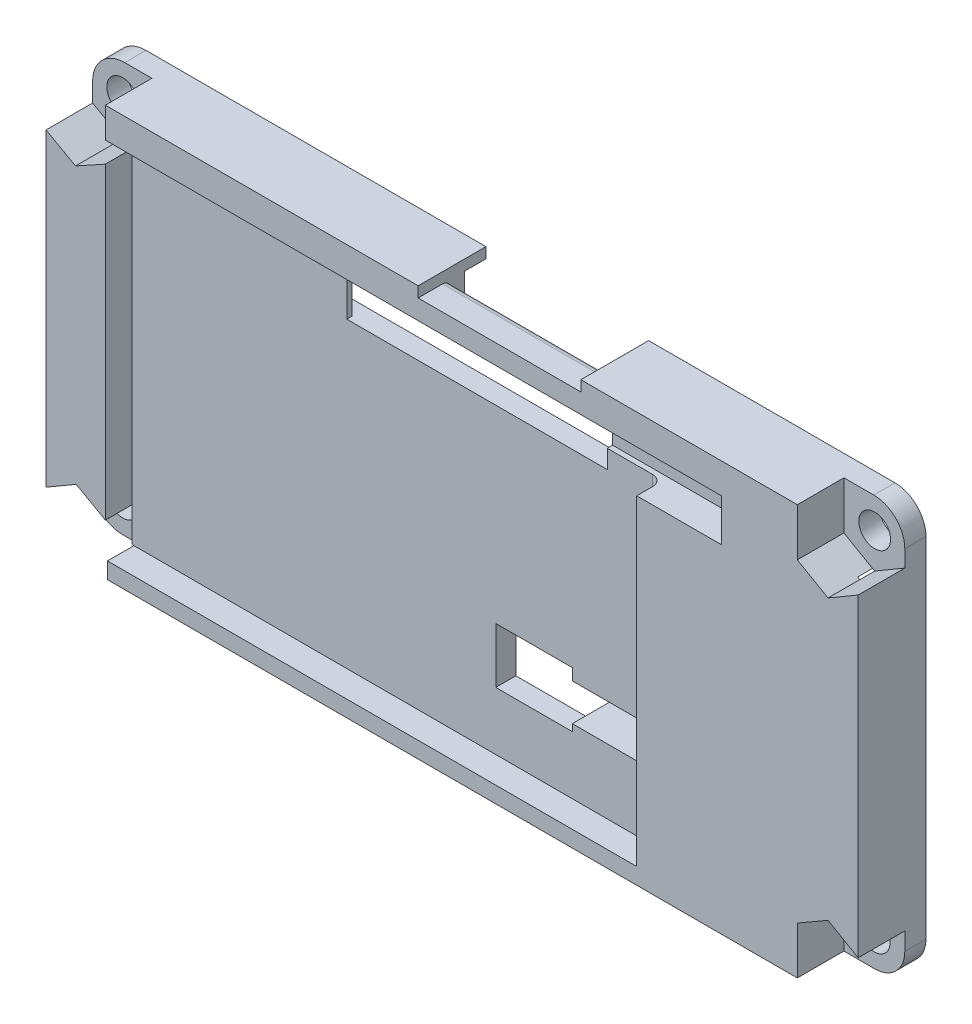
from build123d import *

# Parameters (mm, degrees)
SKETCH_1_R          = 1.5
EXTRUDE_1_DEPTH     = 2
EXTRUDE_1_2_DEPTH   = 2
EXTRUDE_1_3_DEPTH   = 2
SKETCH_1_W          = 4.106423221
SKETCH_1_H          = 16.094809644
EXTRUDE_1_4_DEPTH   = 2
EXTRUDE_2_DEPTH     = 1.4
SKETCH_3_W          = 7.227966662
SKETCH_3_H          = 7.026031467
EXTRUDE_3_DEPTH     = 1.4
SKETCH_4_R          = 1.5
CUT_EXTRUDE_1_DEPTH = 4
EXTRUDE_4_DEPTH     = 3
SKETCH_6_W          = 8
SKETCH_6_H          = 4
CUT_EXTRUDE_2_DEPTH = 3
SKETCH_7_W          = 15.36645454
SKETCH_7_H          = 1
CUT_EXTRUDE_3_DEPTH = 10
FILLET_1_R          = 0.7
CUT_EXTRUDE_START   = -3.4
CUT_EXTRUDE_4_DEPTH = 3.4
SKETCH_9_W          = 0.2
SKETCH_9_H          = 16.094809644
CUT_EXTRUDE_5_DEPTH = 2
SKETCH_10_W         = 0.2
SKETCH_10_H         = 13.963463774
CUT_EXTRUDE_6_DEPTH = 1.4
EXTRUDE_5_DEPTH     = 0.5
FILLET_2_R          = 1
SKETCH_12_W         = 5.692016437
SKETCH_12_H         = 1
SKETCH_12_W_2       = 23.13982976
EXTRUDE_6_DEPTH     = 2


with BuildPart() as part:
    # 草图1 → 凸台-拉伸1 (new body)
    with BuildSketch(Plane.XY):
        with BuildLine():
            Line((-73.533147066, 38.595377191), (-64.568453137, 38.595377191))
            Line((-64.568453137, 38.595377191), (-64.568453137, 29.995377191))
            Line((-64.568453137, 29.995377191), (-75.268453137, 29.995377191))
            Line((-75.268453137, 29.995377191), (-75.268453137, 9.185699771))
            Line((-75.268453137, 9.185699771), (-68.568453137, 9.185699771))
            Line((-68.568453137, 9.185699771), (-68.568453137, -0.114300229))
            Line((-68.568453137, -0.114300229), (-73.787147574, -0.114300229))
            ThreePointArc((-73.787147574, -0.114300229), (-75.753827598, 0.70032531), (-76.568453137, 2.667005334))
            Line((-76.568453137, 2.667005334), (-76.568453137, 35.56007112))
            ThreePointArc((-76.568453137, 35.56007112), (-75.679432572, 37.706356626), (-73.533147066, 38.595377191))
        make_face()
        with Locations((-73.729232918, 35.767081534)):
            Circle(SKETCH_1_R, mode=Mode.SUBTRACT)
        with Locations((-73.729232918, 2.75501651)):
            Circle(SKETCH_1_R, mode=Mode.SUBTRACT)
    extrude(amount=EXTRUDE_1_DEPTH)



with BuildPart() as body_2:
    # 草图1 → Extrude 1 2 (new body)
    with BuildSketch(Plane.XY):
        with BuildLine():
            Line((-20.3701524, 38.595377191), (-2.794005588, 38.595377191))
            ThreePointArc((-2.794005588, 38.595377191), (-0.726529172, 37.739000419), (0.1298476, 35.671524003))
            Line((0.1298476, 35.671524003), (0.1298476, 2.730505461))
            ThreePointArc((0.1298476, 2.730505461), (-0.703376696, 0.718924067), (-2.71495809, -0.114300229))
            Line((-2.71495809, -0.114300229), (-29.3701524, -0.114300229))
            Line((-29.3701524, -0.114300229), (-29.3701524, 7.564313638))
            Line((-29.3701524, 7.564313638), (-21.352987273, 7.564313638))
            Line((-21.352987273, 7.564313638), (-21.352987273, 2.696314027))
            Line((-21.352987273, 2.696314027), (-7.783666391, 2.696314027))
            Line((-7.783666391, 2.696314027), (-7.783666391, 2.08224545))
            Line((-7.783666391, 2.08224545), (-5.4155429, 2.08224545))
            Line((-5.4155429, 2.08224545), (-5.4155429, 6.727722904))
            Line((-5.4155429, 6.727722904), (-4.939400428, 6.727722904))
            Line((-4.939400428, 6.727722904), (-4.939400428, 11.903025146))
            Line((-4.939400428, 11.903025146), (-1.774003048, 11.903025146))
            Line((-1.774003048, 11.903025146), (-1.774003048, 30.503061971))
            ThreePointArc((-1.774003048, 30.503061971), (-3.774007689, 32.503066612), (-5.774012331, 30.503061971))
            Line((-5.774012331, 30.503061971), (-5.774012331, 29.995362765))
            Line((-5.774012331, 29.995362765), (-20.3701524, 29.995362765))
            Line((-20.3701524, 29.995362765), (-20.3701524, 38.595377191))
        make_face()
    extrude(amount=EXTRUDE_1_2_DEPTH)

    # 草图2 → 凸台-拉伸2 (add)
    with BuildSketch(Plane.XY.offset(2)):
        with BuildLine():
            Line((-20.3701524, 38.595377191), (-5.61889189, 38.595377191))
            Line((-5.61889189, 38.595377191), (-5.61889189, 34.083758146))
            Line((-5.61889189, 34.083758146), (-2.721714642, 32.416318003))
            Line((-2.721714642, 32.416318003), (0.1298476, 34.083758146))
            Line((0.1298476, 34.083758146), (0.1298476, 4.412767613))
            Line((0.1298476, 4.412767613), (-2.721714642, 6.053954515))
            Line((-2.721714642, 6.053954515), (-5.620189722, 4.380519147))
            Line((-5.620189722, 4.380519147), (-5.620189722, -0.114300229))
            Line((-5.620189722, -0.114300229), (-29.3701524, -0.114300229))
            Line((-29.3701524, -0.114300229), (-29.3701524, 7.564313638))
            Line((-29.3701524, 7.564313638), (-21.352987273, 7.564313638))
            Line((-21.352987273, 7.564313638), (-20.749621985, 7.564313638))
            ThreePointArc((-20.749621985, 7.564313638), (-18.039737166, 8.686784683), (-16.917266121, 11.396669503))
            Line((-16.917266121, 11.396669503), (-16.917266121, 11.903025146))
            Line((-16.917266121, 11.903025146), (-4.939400428, 11.903025146))
            Line((-4.939400428, 11.903025146), (-1.774003048, 11.903025146))
            Line((-1.774003048, 11.903025146), (-1.774003048, 30.503061971))
            ThreePointArc((-1.774003048, 30.503061971), (-3.774007689, 32.503066612), (-5.774012331, 30.503061971))
            Line((-5.774012331, 30.503061971), (-5.774012331, 29.995362765))
            Line((-5.774012331, 29.995362765), (-20.3701524, 29.995362765))
            Line((-20.3701524, 29.995362765), (-20.3701524, 38.595377191))
        make_face()
        with BuildLine():
            Line((-70.887589638, 38.595377191), (-41.428623377, 38.595377191))
            Line((-41.428623377, 38.595377191), (-41.428623377, 35.071751605))
            Line((-41.428623377, 35.071751605), (-56.286166586, 35.071751605))
            ThreePointArc((-56.286166586, 35.071751605), (-59.39593239, 33.783644433), (-60.684039561, 30.673878629))
            Line((-60.684039561, 30.673878629), (-60.684039561, 29.995362765))
            Line((-60.684039561, 29.995362765), (-64.568453137, 29.995377191))
            Line((-64.568453137, 29.995377191), (-75.268453137, 29.995377191))
            Line((-75.268453137, 29.995377191), (-75.268453137, 9.185699771))
            Line((-75.268453137, 9.185699771), (-68.568453137, 9.185699771))
            Line((-68.568453137, 9.185699771), (-68.568453137, 11.798156954))
            Line((-68.568453137, 11.798156954), (-55.996988093, 11.798156954))
            Line((-55.996988093, 11.798156954), (-55.996988093, 25.761620728))
            Line((-55.996988093, 25.761620728), (-51.890564872, 25.761620728))
            Line((-51.890564872, 25.761620728), (-51.890564872, 29.995362765))
            Line((-51.890564872, 29.995362765), (-21.162764526, 29.995362765))
            Line((-21.162764526, 29.995362765), (-20.622217716, 29.369045696))
            Line((-20.622217716, 29.369045696), (-20.622217716, 22.554127025))
            Line((-20.622217716, 22.554127025), (-20.622217716, 16.103096986))
            Line((-20.622217716, 16.103096986), (-21.974006869, 16.103096986))
            ThreePointArc((-21.974006869, 16.103096986), (-24.074042789, 14.003061066), (-21.974006869, 11.903025146))
            Line((-21.974006869, 11.903025146), (-21.352987273, 11.903025146))
            Line((-21.352987273, 11.903025146), (-21.352987273, 11.060546498))
            Line((-21.352987273, 11.060546498), (-29.3701524, 11.060546498))
            Line((-29.3701524, 11.060546498), (-29.3701524, 12.144142136))
            Line((-29.3701524, 12.144142136), (-36.598119062, 12.144142136))
            Line((-36.598119062, 12.144142136), (-36.598119062, -0.114300229))
            Line((-36.598119062, -0.114300229), (-70.770319773, -0.114300229))
            Line((-70.770319773, -0.114300229), (-70.770319773, 4.547869094))
            Line((-70.770319773, 4.547869094), (-73.7192537, 6.209024912))
            Line((-73.7192537, 6.209024912), (-76.568453137, 4.547869094))
            Line((-76.568453137, 4.547869094), (-76.568453137, 33.773368738))
            Line((-76.568453137, 33.773368738), (-73.787147574, 32.214579336))
            Line((-73.787147574, 32.214579336), (-70.968453137, 33.773368738))
            Line((-70.968453137, 33.773368738), (-70.968453137, 38.595377191))
            Line((-70.968453137, 38.595377191), (-70.887589638, 38.595377191))
        make_face()
    extrude(amount=EXTRUDE_2_DEPTH)


with BuildPart() as body_3:
    # 草图1 → Extrude 1 3 (new body)
    with BuildSketch(Plane.XY):
        with BuildLine():
            Line((-29.3701524, 16.285673783), (-25.719430689, 16.285673783))
            Line((-25.719430689, 16.285673783), (-25.719430689, 22.554127025))
            Line((-25.719430689, 22.554127025), (-20.622217716, 22.554127025))
            Line((-20.622217716, 22.554127025), (-20.622217716, 16.103096986))
            Line((-20.622217716, 16.103096986), (-21.974006869, 16.103096986))
            ThreePointArc((-21.974006869, 16.103096986), (-24.074042789, 14.003061066), (-21.974006869, 11.903025146))
            Line((-21.974006869, 11.903025146), (-21.352987273, 11.903025146))
            Line((-21.352987273, 11.903025146), (-21.352987273, 11.060546498))
            Line((-21.352987273, 11.060546498), (-29.3701524, 11.060546498))
            Line((-29.3701524, 11.060546498), (-29.3701524, 16.285673783))
        make_face()
    extrude(amount=EXTRUDE_1_3_DEPTH)


with BuildPart() as body_4:
    # 草图1 → Extrude 1 4 (new body)
    with BuildSketch(Plane.XY):
        with Locations((-53.943776483, 17.714215906)):
            Rectangle(SKETCH_1_W, SKETCH_1_H)
    extrude(amount=EXTRUDE_1_4_DEPTH)


with BuildPart() as extrude_2_piece_1:
    # of the separate pieces the step leaves, piece 1, a body of its own (extrude_2_pieces)
    add(body_2.part.solids().sort_by_distance((-41.428623377, 38.595377191, 2))[0])


with BuildPart() as extrude_2_piece_2:
    # of the separate pieces the step leaves, piece 2, a body of its own (extrude_2_pieces)
    add(body_2.part.solids().sort_by_distance((-5.774012331, 30.503061971, 0))[0])


with BuildPart() as part_1:
    add(part.part)

    add(body_4.part)  # 凸台-拉伸3 merges body 4

    add(extrude_2_piece_1.part)  # 凸台-拉伸3 merges 凸台-拉伸2 piece 1

    add(extrude_2_piece_2.part)  # 凸台-拉伸3 merges 凸台-拉伸2 piece 2
    # 草图3 → 凸台-拉伸3 (add)
    with BuildSketch(Plane.XY.offset(3.4)):
        Polygon((-20.3701524, 38.595377191), (-20.3701524, 29.995362765), (-20.622217716, 29.995362765), (-20.622217716, 29.369045696), (-21.162764526, 29.995362765), (-26.062168837, 29.995362765), (-26.062168837, 38.595377191), align=None)
        with Locations((-32.984135731, 3.398715505)):
            Rectangle(SKETCH_3_W, SKETCH_3_H)
        with BuildLine():
            Line((-72.936706259, 9.185699771), (-75.268453137, 9.185699771))
            Line((-75.268453137, 9.185699771), (-75.268453137, 11.40305698))
            Line((-75.268453137, 11.40305698), (-75.268453137, 11.798156954))
            Line((-75.268453137, 11.798156954), (-75.008222616, 11.798156954))
            Line((-75.008222616, 11.798156954), (-75.008222616, 11.40305698))
            ThreePointArc((-75.008222616, 11.40305698), (-72.934110955, 9.328945319), (-70.859999295, 11.40305698))
            Line((-70.859999295, 11.40305698), (-70.859999295, 11.798156954))
            Line((-70.859999295, 11.798156954), (-68.568453137, 11.798156954))
            Line((-68.568453137, 11.798156954), (-68.568453137, 9.185699771))
            Line((-68.568453137, 9.185699771), (-72.936706259, 9.185699771))
        make_face()
        with BuildLine():
            Line((-51.890564872, 27.903055626), (-51.890564872, 25.761620728))
            Line((-51.890564872, 25.761620728), (-54.570638132, 25.761620728))
            ThreePointArc((-54.570638132, 25.761620728), (-53.053936471, 26.388408915), (-52.422198631, 27.903055626))
            Line((-52.422198631, 27.903055626), (-52.422198631, 29.995362765))
            Line((-52.422198631, 29.995362765), (-51.890564872, 29.995362765))
            Line((-51.890564872, 29.995362765), (-51.890564872, 27.903055626))
        make_face()
    extrude(amount=-EXTRUDE_3_DEPTH)

    # 草图4 → 切除-拉伸1 (cut)
    with BuildSketch(Plane.XY.offset(3.4)):
        with Locations(Location((-2.71495809, 35.750571501, 0), (0, 0, 180))):
            Circle(SKETCH_4_R)
        with Locations(Location((-2.75986538, 2.75501651, 0), (0, 0, 180))):
            Circle(SKETCH_4_R)
    extrude(amount=-CUT_EXTRUDE_1_DEPTH, mode=Mode.SUBTRACT)

    # 草图5 → 凸台-拉伸4 (add)
    with BuildSketch(Plane.XY.offset(3.4)):
        Polygon((-26.062168837, 38.595377191), (-5.61889189, 38.595377191), (-5.61889189, 34.083758146), (-2.721714642, 32.416318003), (0.1298476, 34.083758146), (0.1298476, 4.412767613), (-2.721714642, 6.053954515), (-5.620189722, 4.380519147), (-5.620189722, -0.114300229), (-70.770319773, -0.114300229), (-70.770319773, 1.42117871), (-20.786805854, 1.42117871), (-20.786805854, 35.738925441), (-70.968453137, 35.738925441), (-70.968453137, 38.595377191), align=None)
        Polygon((-76.568453137, 33.773368738), (-73.787147574, 32.214579336), (-70.968453137, 33.773368738), (-70.968453137, 4.659479052), (-73.7192537, 6.209024912), (-76.568453137, 4.547869094), align=None)
    extrude(amount=EXTRUDE_4_DEPTH)

    # 草图6 → 切除-拉伸2 (cut)
    with BuildSketch(Plane.XY.offset(6.4)):
        with Locations((-16.786805854, 33.738925441)):
            Rectangle(SKETCH_6_W, SKETCH_6_H)
    extrude(amount=-CUT_EXTRUDE_2_DEPTH, mode=Mode.SUBTRACT)

    # 草图7 → 切除-拉伸3 (cut)
    with BuildSketch(Plane(origin=(0, 0, 3.4), x_dir=(-1, 0, 0), z_dir=(0, 0, -1))):
        with Locations((33.745396107, 38.095377191)):
            Rectangle(SKETCH_7_W, SKETCH_7_H)
    extrude(amount=-CUT_EXTRUDE_3_DEPTH, mode=Mode.SUBTRACT)

    # 圆角1
    fillet_1_edges = [part_1.edges().sort_by_distance(p)[0] for p in [
        (-33.745396107, 37.595377191, 3.4),
    ]]
    fillet(fillet_1_edges, radius=FILLET_1_R)


with BuildPart() as cut_extrude_4_tool:
    # 草图8 → 切除-拉伸4 (new body)
    with BuildSketch(Plane(origin=(0, 0, 0), x_dir=(-1, 0, 0), z_dir=(0, 0, -1)).offset(CUT_EXTRUDE_START)):
        with BuildLine():
            Line((5.974012331, 30.195362765), (20.922217716, 30.195362765))
            Line((20.922217716, 30.195362765), (20.922217716, 16.303096986))
            Line((20.922217716, 16.303096986), (21.974006869, 16.303096986))
            ThreePointArc((21.974006869, 16.303096986), (24.274042789, 14.003061066), (21.974006869, 11.703025146))
            Line((21.974006869, 11.703025146), (20.922217716, 11.703025146))
            Line((20.922217716, 11.703025146), (1.574003048, 11.703025146))
            Line((1.574003048, 11.703025146), (1.574003048, 30.295362765))
            Line((1.574003048, 30.295362765), (1.574003048, 30.503061971))
            ThreePointArc((1.574003048, 30.503061971), (3.774007689, 32.703066612), (5.974012331, 30.503061971))
            Line((5.974012331, 30.503061971), (5.974012331, 30.195362765))
        make_face()
    extrude(amount=CUT_EXTRUDE_4_DEPTH)


with BuildPart() as part_2:
    add(part_1.part)

    # 切除-拉伸4: cut by cut_extrude_4_tool
    add(cut_extrude_4_tool.part, mode=Mode.SUBTRACT)

    # 草图9 → 切除-拉伸5 (cut)
    with BuildSketch(Plane(origin=(0, 0, 0), x_dir=(-1, 0, 0), z_dir=(0, 0, -1))):
        with Locations((55.896988093, 17.714215906)):
            Rectangle(SKETCH_9_W, SKETCH_9_H)
    extrude(amount=-CUT_EXTRUDE_5_DEPTH, mode=Mode.SUBTRACT)

    # 草图10 → 切除-拉伸6 (cut)
    with BuildSketch(Plane(origin=(0, 0, 2), x_dir=(-1, 0, 0), z_dir=(0, 0, -1))):
        with Locations((55.896988093, 18.779888841)):
            Rectangle(SKETCH_10_W, SKETCH_10_H)
    extrude(amount=-CUT_EXTRUDE_6_DEPTH, mode=Mode.SUBTRACT)

    # 草图11 → 凸台-拉伸5 (add)
    with BuildSketch(Plane.XY.offset(3.4)):
        Polygon((-70.968453137, 35.738925441), (-50.663857909, 35.738925441), (-50.663857909, 29.995362765), (-26.062168837, 29.995362765), (-26.062168837, 31.738925441), (-20.786805854, 31.738925441), (-20.786805854, 17.473550811), (-20.786805854, 11.060546498), (-29.3701524, 11.060546498), (-29.3701524, 12.144142136), (-36.598119062, 12.144142136), (-36.598119062, 6.911731238), (-29.3701524, 6.911731238), (-29.3701524, 7.564313638), (-20.786805854, 7.564313638), (-20.786805854, 1.42117871), (-29.3701524, 1.42117871), (-36.598119062, 1.42117871), (-50.663857909, 1.42117871), (-70.968453137, 1.42117871), align=None)
    extrude(amount=EXTRUDE_5_DEPTH)

    # 圆角2
    fillet_2_edges = [part_2.edges().sort_by_distance(p)[0] for p in [
        (-20.786805854, 4.492746174, 3.9),
        (-20.786805854, 21.399735969, 3.9),
    ]]
    fillet(fillet_2_edges, radius=FILLET_2_R)

    # 草图12 → 凸台-拉伸6 (add)
    with BuildSketch(Plane(origin=(0, 0, 2), x_dir=(-1, 0, 0), z_dir=(0, 0, -1))):
        with Locations((23.216160619, 38.095377191)):
            Rectangle(SKETCH_12_W, SKETCH_12_H)
        with Locations((52.998538257, 38.095377191)):
            Rectangle(SKETCH_12_W_2, SKETCH_12_H)
    extrude(amount=EXTRUDE_6_DEPTH)


with BuildPart() as body_3_1:
    add(body_3.part)

    # 切除-拉伸4: cut by cut_extrude_4_tool
    add(cut_extrude_4_tool.part, mode=Mode.SUBTRACT)


solid = Compound([part_2.part, body_3_1.part])
